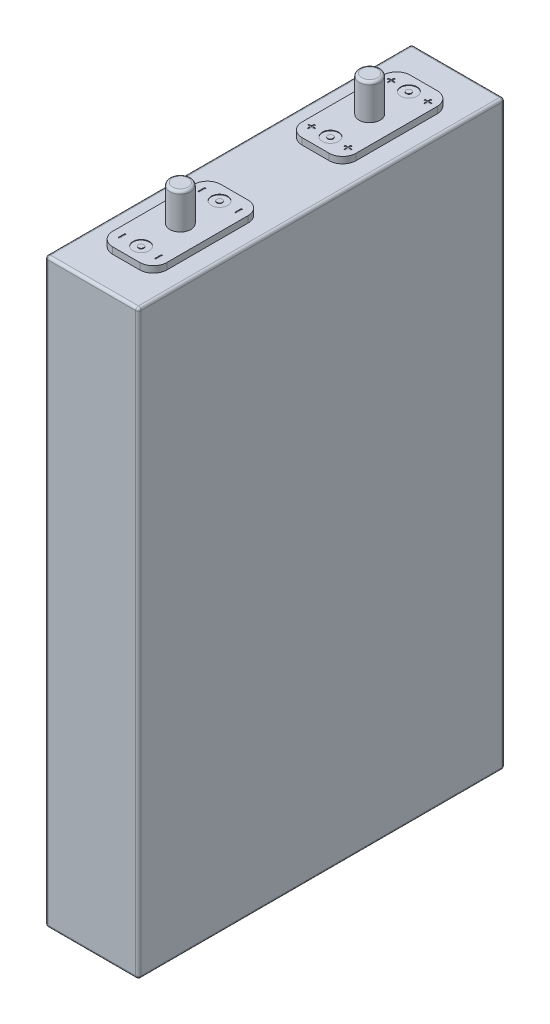
from build123d import *

# Parameters (mm, degrees)
SKETCH1_W               = 135.5
SKETCH1_H               = 215
BOSS_EXTRUDE1_DEPTH     = 17.25
SKETCH2_R               = 3.9
BOSS_EXTRUDE2_DEPTH     = 15.5
BOSS_EXTRUDE2_2_DEPTH   = 15.5
SKETCH3_R               = 3.9
BOSS_EXTRUDE3_DEPTH     = 2.4
SKETCH5_R               = 3
SKETCH5_R_2             = 1
CUT_EXTRUDE1_DEPTH      = 0.2
FILLET1_R               = 1
FILLET2_R               = 1
FILLET3_R               = 1
CUT_EXTRUDE2_DEPTH      = 0.2
MIRROR3_COPY_1_DEPTH    = 0.2
SKETCH7_W               = 0.5
SKETCH7_H               = 2.5
CUT_EXTRUDE3_DEPTH      = 0.2
MIRROR5_COPY_1_SKETCH_W = 0.5
MIRROR5_COPY_1_SKETCH_H = 2.5
MIRROR5_COPY_1_DEPTH    = 0.2
FILLET4_R               = 1
FILLET5_R               = 1


with BuildPart() as part:
    # Sketch1 → Boss-Extrude1 (new, symmetric)
    with BuildSketch(Plane(origin=(0, 0, 0), x_dir=(0, 0, -1), z_dir=(1, 0, 0))):
        Rectangle(SKETCH1_W, SKETCH1_H)
    extrude(amount=BOSS_EXTRUDE1_DEPTH, both=True)

    # Fillet1
    fillet1_edges = [part.edges().sort_by_distance(p)[0] for p in [
        (17.25, 0, -67.75),
        (17.25, 0, 67.75),
        (-17.25, 0, -67.75),
        (-17.25, 0, 67.75),
    ]]
    fillet(fillet1_edges, radius=FILLET1_R)

    # Fillet2
    fillet2_edges = [part.edges().sort_by_distance(p)[0] for p in [
        (17.25, 107.5, 0),
        (-17.25, 107.5, 0),
        (0, 107.5, 67.75),
        (0, 107.5, -67.75),
        (-16.957106781, 107.5, 67.457106781),
        (16.957106781, 107.5, 67.457106781),
        (-16.957106781, 107.5, -67.457106781),
        (16.957106781, 107.5, -67.457106781),
    ]]
    fillet(fillet2_edges, radius=FILLET2_R)

    # Fillet3
    fillet3_edges = [part.edges().sort_by_distance(p)[0] for p in [
        (17.25, -107.5, 0),
        (0, -107.5, -67.75),
        (-17.25, -107.5, 0),
        (0, -107.5, 67.75),
        (-16.957106781, -107.5, 67.457106781),
        (16.957106781, -107.5, 67.457106781),
        (-16.957106781, -107.5, -67.457106781),
        (16.957106781, -107.5, -67.457106781),
    ]]
    fillet(fillet3_edges, radius=FILLET3_R)


with BuildPart() as body_2:
    # Sketch2 → Boss-Extrude2 (new body)
    with BuildSketch(Plane(origin=(0, 107.5, 0), x_dir=(1, 0, 0), z_dir=(0, 1, 0))):
        with Locations(Location((0, -35, 0), (0, 0, 270))):
            Circle(SKETCH2_R)
    extrude(amount=BOSS_EXTRUDE2_DEPTH)

    # Fillet5
    fillet5_edges = [body_2.edges().sort_by_distance(p)[0] for p in [
        (0, 123, 31.1),
    ]]
    fillet(fillet5_edges, radius=FILLET5_R)


with BuildPart() as body_3:
    # Sketch2 → Boss-Extrude2 2 (new body)
    with BuildSketch(Plane(origin=(0, 107.5, 0), x_dir=(1, 0, 0), z_dir=(0, 1, 0))):
        with Locations(Location((0, 35, 0), (0, 0, 90))):
            Circle(SKETCH2_R)
    extrude(amount=BOSS_EXTRUDE2_2_DEPTH)

    # Fillet4
    fillet4_edges = [body_3.edges().sort_by_distance(p)[0] for p in [
        (0, 123, -31.1),
    ]]
    fillet(fillet4_edges, radius=FILLET4_R)


with BuildPart() as body_4:
    # Sketch3 → Boss-Extrude3 (new body)
    with BuildSketch(Plane(origin=(0, 107.5, 0), x_dir=(1, 0, 0), z_dir=(0, 1, 0))):
        with BuildLine():
            Line((-5, 55), (5, 55))
            ThreePointArc((5, 55), (8.535533906, 53.535533906), (10, 50))
            Line((10, 50), (10, 20))
            ThreePointArc((10, 20), (8.535533906, 16.464466094), (5, 15))
            Line((5, 15), (-5, 15))
            ThreePointArc((-5, 15), (-8.535533906, 16.464466094), (-10, 20))
            Line((-10, 20), (-10, 50))
            ThreePointArc((-10, 50), (-8.535533906, 53.535533906), (-5, 55))
        make_face()
        with Locations(Location((0, 35, 0), (0, 0, 270))):
            Circle(SKETCH3_R, mode=Mode.SUBTRACT)
    extrude(amount=BOSS_EXTRUDE3_DEPTH)

    # Sketch5 → Cut-Extrude1 (cut)
    # profile 1 of 2: a face of its own
    with BuildSketch(Plane(origin=(0, 109.9, 0), x_dir=(1, 0, 0), z_dir=(0, 1, 0))):
        with Locations(Location((0, 49.5, 0), (0, 0, 270))):
            Circle(SKETCH5_R)
        with Locations(Location((0, 49.5, 0), (0, 0, 270))):
            Circle(SKETCH5_R_2, mode=Mode.SUBTRACT)
    # profile 2 of 2: a face of its own
    with BuildSketch(Plane(origin=(0, 109.9, 0), x_dir=(1, 0, 0), z_dir=(0, 1, 0))):
        with Locations(Location((0, 20.5, 0), (0, 0, 90))):
            Circle(SKETCH5_R)
        with Locations(Location((0, 20.5, 0), (0, 0, 270))):
            Circle(SKETCH5_R_2, mode=Mode.SUBTRACT)
    extrude(amount=-CUT_EXTRUDE1_DEPTH, mode=Mode.SUBTRACT)


with BuildPart() as body_5:
    # Mirror1: mirrored copy
    add(body_4.part.mirror(Plane.XY))

    # Sketch7 → Cut-Extrude3 (cut)
    with BuildSketch(Plane(origin=(0, 109.9, 0), x_dir=(1, 0, 0), z_dir=(0, 1, 0))):
        with Locations((-6.75, -49.75)):
            Rectangle(SKETCH7_W, SKETCH7_H)
    cut_extrude3 = extrude(amount=-CUT_EXTRUDE3_DEPTH, mode=Mode.SUBTRACT)

    # Mirror4: Cut-Extrude3 across plane
    add(cut_extrude3.mirror(Plane.ZY), mode=Mode.SUBTRACT)

    # Mirror5: Cut-Extrude3 across plane
    add(cut_extrude3.mirror(Plane.XY.offset(35)), mode=Mode.SUBTRACT)

    # Mirror5 copy 1 sketch → Mirror5 copy 1 (cut)
    with BuildSketch(Plane(origin=(0, 109.9, 70), x_dir=(-1, 0, 0), z_dir=(0, 1, 0))):
        with Locations((-6.75, -49.75)):
            Rectangle(MIRROR5_COPY_1_SKETCH_W, MIRROR5_COPY_1_SKETCH_H)
    extrude(amount=-MIRROR5_COPY_1_DEPTH, mode=Mode.SUBTRACT)


with BuildPart() as body_4_1:
    add(body_4.part)

    # Sketch6 → Cut-Extrude2 (cut)
    with BuildSketch(Plane(origin=(0, 109.9, 0), x_dir=(1, 0, 0), z_dir=(0, 1, 0))):
        Polygon((-7, 49.5), (-7, 48.5), (-6.5, 48.5), (-6.5, 49.5), (-5.5, 49.5), (-5.5, 50), (-6.5, 50), (-6.5, 51), (-7, 51), (-7, 50), (-8, 50), (-8, 49.5), align=None)
    cut_extrude2 = extrude(amount=-CUT_EXTRUDE2_DEPTH, mode=Mode.SUBTRACT)

    # Mirror2: Cut-Extrude2 across plane
    add(cut_extrude2.mirror(Plane(origin=(0, 0, 0), x_dir=(0, 0, 1), z_dir=(1, 0, 0))), mode=Mode.SUBTRACT)

    # Mirror3: Cut-Extrude2 across plane
    add(cut_extrude2.mirror(Plane.XY.offset(-35)), mode=Mode.SUBTRACT)

    # Mirror3 copy 1 sketch → Mirror3 copy 1 (cut)
    with BuildSketch(Plane(origin=(0, 109.9, -70), x_dir=(-1, 0, 0), z_dir=(0, 1, 0))):
        Polygon((-7, 49.5), (-7, 48.5), (-6.5, 48.5), (-6.5, 49.5), (-5.5, 49.5), (-5.5, 50), (-6.5, 50), (-6.5, 51), (-7, 51), (-7, 50), (-8, 50), (-8, 49.5), align=None)
    extrude(amount=-MIRROR3_COPY_1_DEPTH, mode=Mode.SUBTRACT)


solid = Compound([part.part, body_2.part, body_3.part, body_5.part, body_4_1.part])
